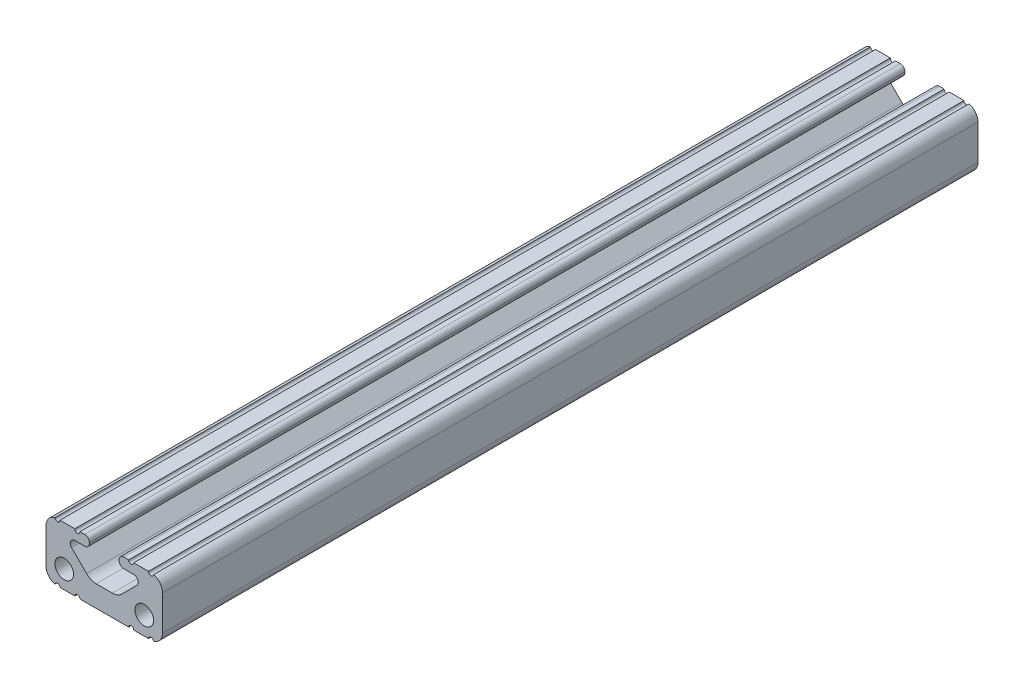
from build123d import *

# Parameters (mm, degrees)
SKETCH3_R               = 2.032
BOSS_EXTRUDE1_DEPTH     = 152.4
CUT_EXTRUDE1_DEPTH      = 154.060029074
CUT_EXTRUDE1_DEPTH_BACK = 154.060029074
SKETCH4_R               = 0.55245
CUT_EXTRUDE2_DEPTH      = 127


with BuildPart() as part:
    # Sketch3 → Boss-Extrude1 (new, symmetric)
    with BuildSketch(Plane.XY):
        with BuildLine():
            Line((3.2512, 5.35559), (3.2512, 5.13461))
            ThreePointArc((3.2512, 5.13461), (3.542455946, 4.431455946), (4.24561, 4.1402))
            Line((4.24561, 4.1402), (6.42239, 4.1402))
            ThreePointArc((6.42239, 4.1402), (7.341105046, 3.526334232), (7.125544054, 2.442635946))
            Line((7.125544054, 2.442635946), (3.854875946, -0.828032163))
            ThreePointArc((3.854875946, -0.828032163), (2.887046479, -1.474715138), (1.745413783, -1.7018))
            Line((1.745413783, -1.7018), (0, -1.7018))
            Line((0, -1.7018), (0, -6.35))
            Line((0, -6.35), (10.16, -6.35))
            ThreePointArc((10.16, -6.35), (11.956051224, -5.606051224), (12.7, -3.81))
            Line((12.7, -3.81), (12.7, 3.81))
            ThreePointArc((12.7, 3.81), (11.956051224, 5.606051224), (10.16, 6.35))
            Line((10.16, 6.35), (4.24561, 6.35))
            ThreePointArc((4.24561, 6.35), (3.542455946, 6.058744054), (3.2512, 5.35559))
        make_face()
        with Locations(Location((8.7249, -2.3876, 0), (0, 0, 180))):
            Circle(SKETCH3_R, mode=Mode.SUBTRACT)
    extrude(amount=BOSS_EXTRUDE1_DEPTH, both=True)

    # Sketch4 → Cut-Extrude1 (cut, two sides: drawn at the far end of the back side and taken through both)
    with BuildSketch(Plane.XY.offset(-CUT_EXTRUDE1_DEPTH_BACK)):
        with Locations((5.86994, 6.35)):
            Circle(SKETCH4_R)
        with Locations((10.20445, 6.35)):
            Circle(SKETCH4_R)
        with Locations((5.86994, -6.35)):
            Circle(SKETCH4_R)
        with Locations((10.20445, -6.35)):
            Circle(SKETCH4_R)
    extrude(amount=CUT_EXTRUDE1_DEPTH + CUT_EXTRUDE1_DEPTH_BACK, mode=Mode.SUBTRACT)

    # Mirror1: part across plane


with BuildPart() as part_1:
    add(part.part)
    add(part.part.mirror(Plane(origin=(0, 0, 0), x_dir=(0, 0, 1), z_dir=(1, 0, 0))))

    # Sketch5 → Cut-Extrude2 (cut)
    with BuildSketch(Plane.XY.offset(152.4)):
        with BuildLine():
            Line((9.652, 6.35), (6.42239, 6.35))
            ThreePointArc((6.42239, 6.35), (5.86994, 5.79755), (5.31749, 6.35))
            Line((5.31749, 6.35), (4.24561, 6.35))
            ThreePointArc((4.24561, 6.35), (3.542455946, 6.058744054), (3.2512, 5.35559))
            Line((3.2512, 5.35559), (3.2512, 5.13461))
            ThreePointArc((3.2512, 5.13461), (3.542455946, 4.431455946), (4.24561, 4.1402))
            Line((4.24561, 4.1402), (6.42239, 4.1402))
            ThreePointArc((6.42239, 4.1402), (7.341105046, 3.526334232), (7.125544054, 2.442635946))
            Line((7.125544054, 2.442635946), (3.854875946, -0.828032163))
            ThreePointArc((3.854875946, -0.828032163), (2.887046479, -1.474715138), (1.745413783, -1.7018))
            Line((1.745413783, -1.7018), (-1.745413783, -1.7018))
            ThreePointArc((-1.745413783, -1.7018), (-2.887046479, -1.474715138), (-3.854875946, -0.828032163))
            Line((-3.854875946, -0.828032163), (-7.125544054, 2.442635946))
            ThreePointArc((-7.125544054, 2.442635946), (-7.341105046, 3.526334232), (-6.42239, 4.1402))
            Line((-6.42239, 4.1402), (-4.24561, 4.1402))
            ThreePointArc((-4.24561, 4.1402), (-3.542455946, 4.431455946), (-3.2512, 5.13461))
            Line((-3.2512, 5.13461), (-3.2512, 5.35559))
            ThreePointArc((-3.2512, 5.35559), (-3.542455946, 6.058744054), (-4.24561, 6.35))
            Line((-4.24561, 6.35), (-5.31749, 6.35))
            ThreePointArc((-5.31749, 6.35), (-5.86994, 5.79755), (-6.42239, 6.35))
            Line((-6.42239, 6.35), (-9.652, 6.35))
            ThreePointArc((-9.652, 6.35), (-10.169350236, 5.798666155), (-10.752439892, 6.279942302))
            ThreePointArc((-10.752439892, 6.279942302), (-12.154542219, 5.382705102), (-12.7, 3.81))
            Line((-12.7, 3.81), (-12.7, -3.81))
            ThreePointArc((-12.7, -3.81), (-12.154542219, -5.382705102), (-10.752439892, -6.279942302))
            ThreePointArc((-10.752439892, -6.279942302), (-10.169350236, -5.798666155), (-9.652, -6.35))
            Line((-9.652, -6.35), (-6.42239, -6.35))
            ThreePointArc((-6.42239, -6.35), (-5.86994, -5.79755), (-5.31749, -6.35))
            Line((-5.31749, -6.35), (5.31749, -6.35))
            ThreePointArc((5.31749, -6.35), (5.86994, -5.79755), (6.42239, -6.35))
            Line((6.42239, -6.35), (9.652, -6.35))
            ThreePointArc((9.652, -6.35), (10.169350236, -5.798666155), (10.752439892, -6.279942302))
            ThreePointArc((10.752439892, -6.279942302), (12.154542219, -5.382705102), (12.7, -3.81))
            Line((12.7, -3.81), (12.7, 3.81))
            ThreePointArc((12.7, 3.81), (12.154542219, 5.382705102), (10.752439892, 6.279942302))
            ThreePointArc((10.752439892, 6.279942302), (10.169350236, 5.798666155), (9.652, 6.35))
        make_face()
    extrude(amount=-CUT_EXTRUDE2_DEPTH, mode=Mode.SUBTRACT)


solid = part_1.part
